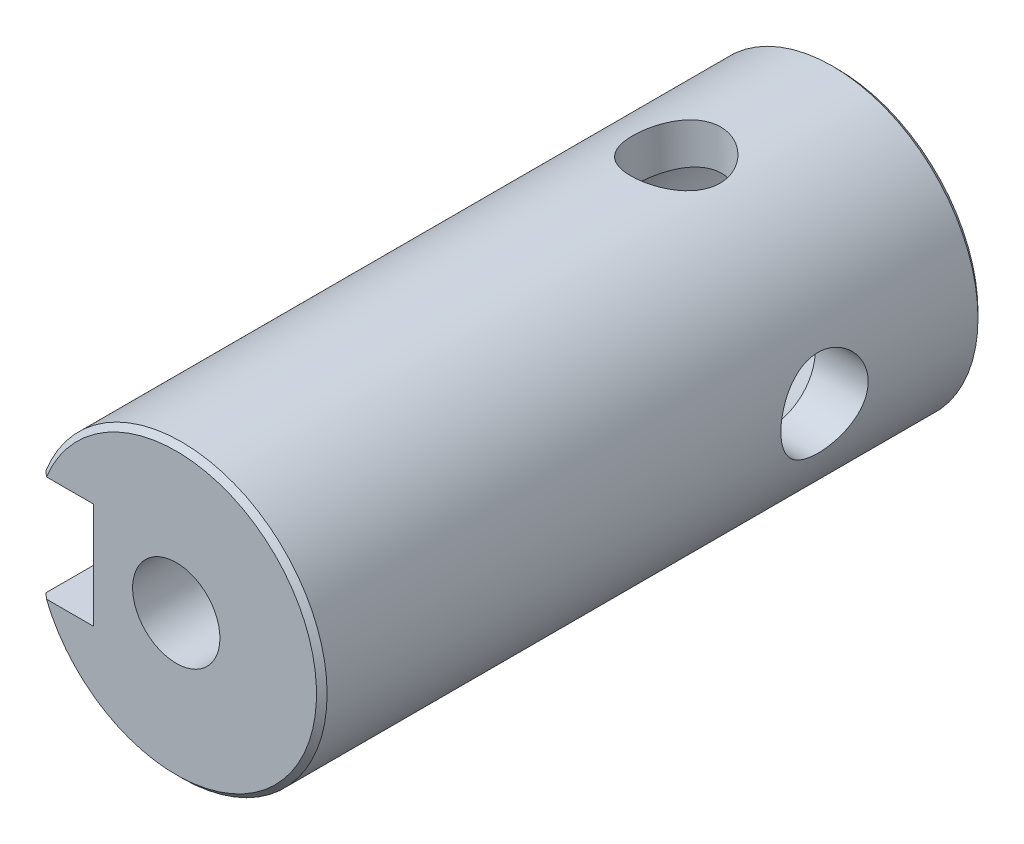
from build123d import *
from build123d.topology import SkipClean

# Parameters (mm, degrees)
SKETCH_1_R              = 5.5
EXTRUDE_1_DEPTH         = 18
SKETCH_2_R              = 4
CUT_EXTRUDE_1_DEPTH     = 18
EXTRUDE_2_DEPTH         = 18
CUT_EXTRUDE_3_DEPTH     = 6
EXTRUDE_START           = 6
EXTRUDE_3_DEPTH         = 6
SKETCH_11_R             = 5.5
EXTRUDE_4_DEPTH         = 7
EXTRUDE_START_2         = 2
SKETCH_15_R             = 5.5
EXTRUDE_5_DEPTH         = 2
HOLE_WIZARD_M4_4_D      = 3.3
CUT_EXTRUDE_8_DEPTH     = 8
SKETCH_20_W             = 0.38
SKETCH_20_H             = 4
CUT_EXTRUDE_9_DEPTH     = 8
HOLE_WIZARD_M4_9_D      = 3.3
HOLE_WIZARD_M4_9_DEPTH  = 2
HOLE_WIZARD_M4_10_D     = 3.3
HOLE_WIZARD_M4_10_DEPTH = 1.5
CHAMFER_2_SIZE          = 0.2
CHAMFER_3_SIZE          = 0.2


with BuildPart() as part:
    # 草图1 → 凸台-拉伸1 (new body)
    with BuildSketch(Plane.XY):
        Circle(SKETCH_1_R)
    extrude(amount=EXTRUDE_1_DEPTH)

    # 草图2 → 切除-拉伸1 (cut)
    with BuildSketch(Plane(origin=(0, 0, 0), x_dir=(-1, 0, 0), z_dir=(0, 0, -1))):
        Circle(SKETCH_2_R)
    extrude(amount=-CUT_EXTRUDE_1_DEPTH, mode=Mode.SUBTRACT)

    # 草图3 → 凸台-拉伸2 (add)
    with BuildSketch(Plane(origin=(0, 0, 0), x_dir=(-1, 0, 0), z_dir=(0, 0, -1))):
        Polygon((-3.5, 0), (-3.5, 2.515567), (-4.944421, -0.303566), (-4.222211, -2.180275), (-3.5, -2.180275), align=None)
    extrude(amount=-EXTRUDE_2_DEPTH)

    # 草图5 → 切除-拉伸3 (cut)
    with BuildSketch(Plane(origin=(0, 0, 0), x_dir=(-1, 0, 0), z_dir=(0, 0, -1))):
        Polygon((-4.5, 0), (-4.5, -1.5), (-5.291503, -1.5), (-6.679987, 0.400671), (-5.291503, 1.5), (-4.5, 1.5), align=None)
    extrude(amount=-CUT_EXTRUDE_3_DEPTH, mode=Mode.SUBTRACT)

    # 草图6 → 凸台-拉伸3 (add)
    with SkipClean():  # the faces are left unmerged after this step: merging them gives an invalid solid
        with BuildSketch(Plane(origin=(0, 0, 6), x_dir=(-1, 0, 0), z_dir=(0, 0, -1)).offset(EXTRUDE_START)):
            with BuildLine():
                Line((-5.291503, -1.5), (-4.238481, -1.644386))
                Line((-4.238481, -1.644386), (-3.814049, 1.930313))
                Line((-3.814049, 1.930313), (-5.291503, 1.5))
                ThreePointArc((-5.291503, 1.5), (-5.5, 0), (-5.291503, -1.5))
            make_face()
        extrude(amount=-EXTRUDE_3_DEPTH)

    # 草图11 → 凸台-拉伸4 (add)
    with SkipClean():  # the faces are left unmerged after this step: merging them gives an invalid solid
        with BuildSketch(Plane.XY.offset(18)):
            Circle(SKETCH_11_R)
        extrude(amount=EXTRUDE_4_DEPTH)

    # 草图15 → 凸台-拉伸5 (add)
    with SkipClean():  # the faces are left unmerged after this step: merging them gives an invalid solid
        with BuildSketch(Plane(origin=(0, 0, 18), x_dir=(-1, 0, 0), z_dir=(0, 0, -1)).offset(EXTRUDE_START_2)):
            with Locations(Location((0, 0, 0), (0, 0, 180))):
                Circle(SKETCH_15_R)
        extrude(amount=-EXTRUDE_5_DEPTH)

    # M4 螺纹孔4 (through all)
    with Locations(Plane.XY.offset(25)):
        with Locations((0, 0)):
            Hole(HOLE_WIZARD_M4_4_D / 2)

    # 草图19 → 切除-拉伸8 (cut)
    with SkipClean():  # the faces are left unmerged after this step: merging them gives an invalid solid
        with BuildSketch(Plane.XY.offset(25)):
            Polygon((-5.5, 0), (-5.5, -2), (-3.5, -2), (-3.5, 2), (-5.5, 2), align=None)
        extrude(amount=-CUT_EXTRUDE_8_DEPTH, mode=Mode.SUBTRACT)

    # 草图20 → 切除-拉伸9 (cut)
    with SkipClean():  # the faces are left unmerged after this step: merging them gives an invalid solid
        with BuildSketch(Plane.XY.offset(25)):
            with Locations((-3.31, 0)):
                Rectangle(SKETCH_20_W, SKETCH_20_H)
        extrude(amount=-CUT_EXTRUDE_9_DEPTH, mode=Mode.SUBTRACT)

    # M4 螺纹孔9
    with Locations(Plane(origin=(3.5, 0, 6), x_dir=(0, 0, -1), z_dir=(-1, 0, 0))):
        with Locations((0, 0)):
            Hole(HOLE_WIZARD_M4_9_D / 2, depth=HOLE_WIZARD_M4_9_DEPTH)

    # M4 螺纹孔10
    with Locations(Plane(origin=(-0.112691, 3.998412, 5.952809), x_dir=(-0.999603066556, -0.028172847433, 0), z_dir=(0.028172847433, -0.999603066556, 0))):
        with Locations((0, 0)):
            Hole(HOLE_WIZARD_M4_10_D / 2, depth=HOLE_WIZARD_M4_10_DEPTH)

    # 倒角2
    chamfer_2_edges = [part.edges().sort_by_distance(p)[0] for p in [
        (1.017567, 5.405049, 25),
    ]]
    chamfer(chamfer_2_edges, length=CHAMFER_2_SIZE)

    # 倒角3
    chamfer_3_edges = [part.edges().sort_by_distance(p)[0] for p in [
        (-5.291503, -1.5, 0),
    ]]
    chamfer(chamfer_3_edges, length=CHAMFER_3_SIZE)


solid = part.part
